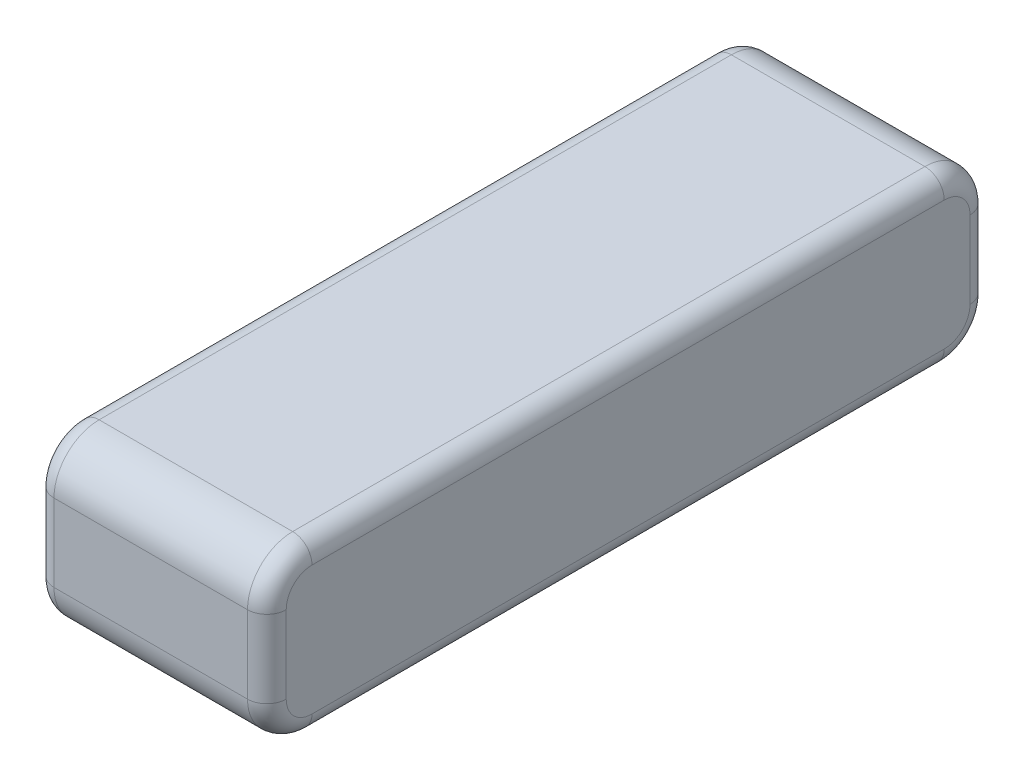
from build123d import *

# Parameters (mm, degrees)
BOSS_EXTRUDE1_DEPTH = 18
FILLET1_R           = 3


with BuildPart() as part:
    # Sketch1 → Boss-Extrude1 (new, symmetric)
    with BuildSketch(Plane(origin=(0, 0, 0), x_dir=(0, 0, -1), z_dir=(1, 0, 0))):
        with BuildLine():
            Line((-49, 13), (49, 13))
            ThreePointArc((49, 13), (53.949747468, 10.949747468), (56, 6))
            Line((56, 6), (56, -6))
            ThreePointArc((56, -6), (53.949747468, -10.949747468), (49, -13))
            Line((49, -13), (-49, -13))
            ThreePointArc((-49, -13), (-53.949747468, -10.949747468), (-56, -6))
            Line((-56, -6), (-56, 6))
            ThreePointArc((-56, 6), (-53.949747468, 10.949747468), (-49, 13))
        make_face()
    extrude(amount=BOSS_EXTRUDE1_DEPTH, both=True)

    # Fillet1
    fillet1_edges = [part.edges().sort_by_distance(p)[0] for p in [
        (18, 10.949747468, 53.949747468),
        (-18, 13, 0),
        (-18, 10.949747468, -53.949747468),
        (18, 0, 56),
        (18, -10.949747468, 53.949747468),
        (18, -13, 0),
        (18, -10.949747468, -53.949747468),
        (18, 0, -56),
        (18, 10.949747468, -53.949747468),
        (18, 13, 0),
        (-18, 0, -56),
        (-18, -10.949747468, -53.949747468),
        (-18, -13, 0),
        (-18, -10.949747468, 53.949747468),
        (-18, 0, 56),
        (-18, 10.949747468, 53.949747468),
    ]]
    fillet(fillet1_edges, radius=FILLET1_R)


solid = part.part
